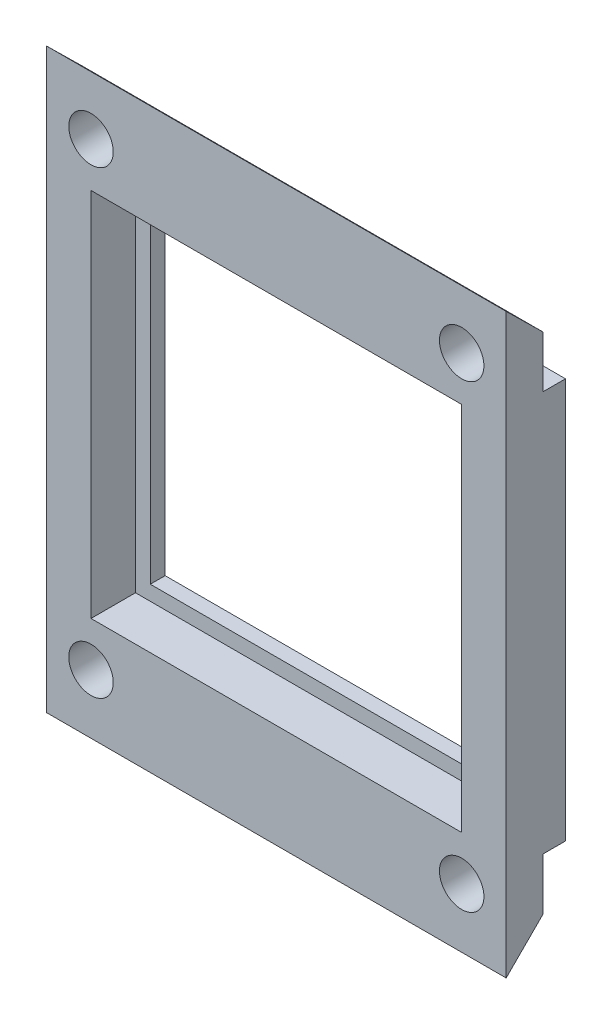
from build123d import *

# Parameters (mm, degrees)
SKETCH3_W               = 31
SKETCH3_H               = 31
BOSS_EXTRUDE2_DEPTH     = 4
SKETCH4_W               = 25
SKETCH4_H               = 25
CUT_EXTRUDE1_DEPTH      = 3
SKETCH5_W               = 23
SKETCH5_H               = 23
CUT_EXTRUDE2_DEPTH      = 5
SKETCH9_R               = 1.5
CUT_EXTRUDE3_DEPTH      = 10
MIRROR3_COPY_1_SKETCH_R = 1.5
MIRROR3_COPY_1_DEPTH    = 10
CUT_EXTRUDE4_DEPTH      = 37.84087404


with BuildPart() as part:
    # Sketch3 → Boss-Extrude2 (new body)
    with BuildSketch(Plane.XY):
        Rectangle(SKETCH3_W, SKETCH3_H)
    extrude(amount=BOSS_EXTRUDE2_DEPTH)

    # Sketch4 → Cut-Extrude1 (cut)
    with BuildSketch(Plane.XY.offset(4)):
        Rectangle(SKETCH4_W, SKETCH4_H)
    extrude(amount=-CUT_EXTRUDE1_DEPTH, mode=Mode.SUBTRACT)

    # Sketch5 → Cut-Extrude2 (cut)
    with BuildSketch(Plane.XY.offset(1)):
        Rectangle(SKETCH5_W, SKETCH5_H)
    extrude(amount=-CUT_EXTRUDE2_DEPTH, mode=Mode.SUBTRACT)

    # Sweep1: sweep along a curve in space
    with BuildLine() as sweep1_path:
        Line((-15.5, -15.5, 4), (15.5, -15.5, 4))
    # Sketch6 → Sweep1 (sweep)
    with BuildSketch(Plane.ZY.offset(15.5)):
        Polygon((4, -15.5), (4, -19.5), (0, -15.5), align=None)
    sweep(path=sweep1_path.line)

    # Sweep2: sweep along a curve in space
    with BuildLine() as sweep2_path:
        Line((15.5, 15.5, 0), (-15.5, 15.5, 0))
    # Sketch8 → Sweep2 (sweep)
    with BuildSketch(Plane.ZY.offset(15.5)):
        Polygon((0, 15.5), (4, 19.43634716), (4, 15.5), align=None)
    sweep(path=sweep2_path.line)

    # Sketch9 → Cut-Extrude3 (cut)
    with BuildSketch(Plane(origin=(0, 0, 0), x_dir=(-1, 0, 0), z_dir=(0, 0, -1))):
        with Locations((-12.5, 15.5)):
            Circle(SKETCH9_R)
    cut_extrude3 = extrude(amount=-CUT_EXTRUDE3_DEPTH, mode=Mode.SUBTRACT)

    # Mirror1: Cut-Extrude3 across plane
    add(cut_extrude3.mirror(Plane(origin=(0, 0, 0), x_dir=(0, 0, 1), z_dir=(1, 0, 0))), mode=Mode.SUBTRACT)

    # Mirror3: Cut-Extrude3 across plane
    add(cut_extrude3.mirror(Plane.ZX), mode=Mode.SUBTRACT)

    # Mirror3 copy 1 sketch → Mirror3 copy 1 (cut)
    with BuildSketch(Plane(origin=(0, 0, 0), x_dir=(1, 0, 0), z_dir=(0, 0, -1))):
        with Locations((-12.5, 15.5)):
            Circle(MIRROR3_COPY_1_SKETCH_R)
    extrude(amount=-MIRROR3_COPY_1_DEPTH, mode=Mode.SUBTRACT)

    # Sketch10 → Cut-Extrude4 (cut, through all)
    with BuildSketch(Plane.ZY.offset(15.5)):
        Polygon((0, -15.5), (1.5, -17), (1.5, -13.5), (0, -13.5), align=None)
        Polygon((1.524255803, 17), (0, 15.5), (0, 13.5), (1.524255803, 13.5), align=None)
    extrude(amount=-CUT_EXTRUDE4_DEPTH, mode=Mode.SUBTRACT)


solid = part.part
